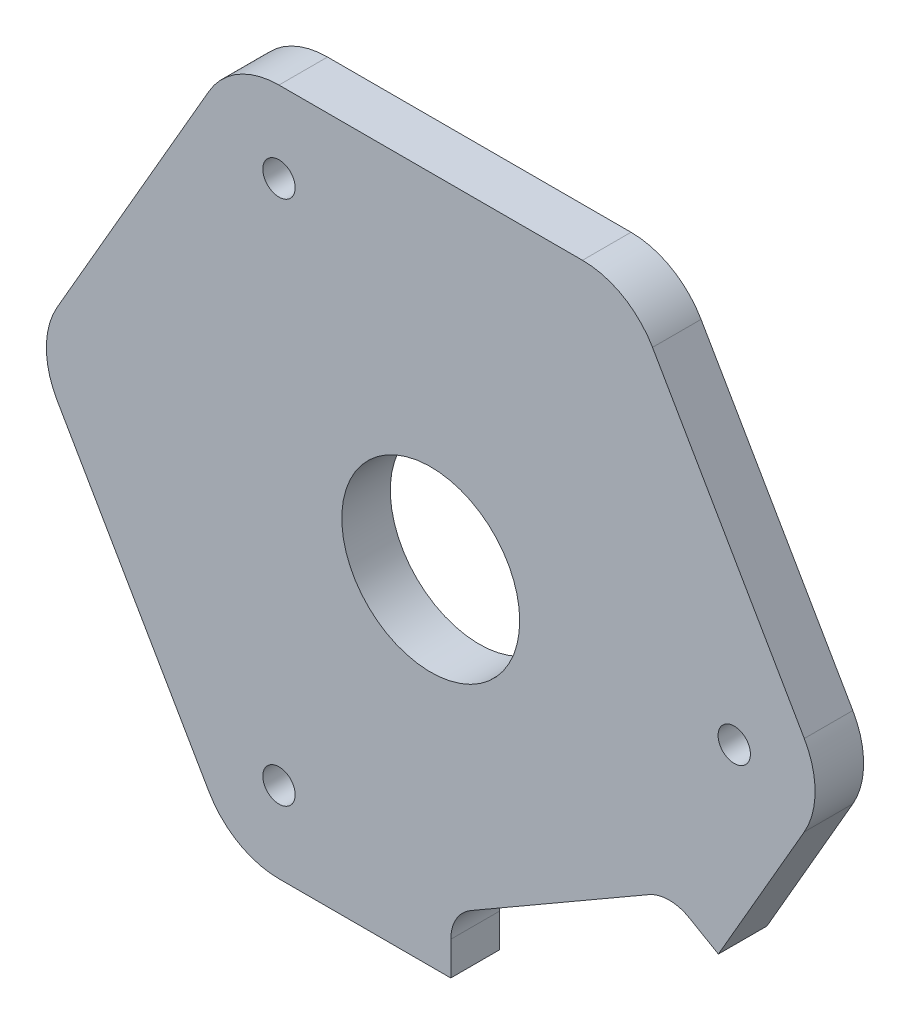
from build123d import *

# Parameters (mm, degrees)
SKETCH1_R           = 2
SKETCH1_R_2         = 11
BOSS_EXTRUDE1_DEPTH = 6


with BuildPart() as part:
    # Sketch1 → Boss-Extrude1 (new body)
    with BuildSketch(Plane.XY):
        with BuildLine():
            Line((-95.228511525, 77.345498823), (-73.987721787, 77.345498823))
            Line((-73.987721787, 77.345498823), (-73.987721787, 81.491705922))
            ThreePointArc((-73.987721787, 81.491705922), (-73.317848806, 83.991705922), (-71.487721787, 85.821832941))
            Line((-71.487721787, 85.821832941), (-49.487721787, 98.523538863))
            ThreePointArc((-49.487721787, 98.523538863), (-46.987721787, 99.193411844), (-44.487721787, 98.523538863))
            Line((-44.487721787, 98.523538863), (-40.89700111, 96.450435314))
            Line((-40.89700111, 96.450435314), (-30.276606241, 114.845498823))
            ThreePointArc((-30.276606241, 114.845498823), (-28.936860279, 119.845498823), (-30.276606241, 124.845498823))
            Line((-30.276606241, 124.845498823), (-49.04048999, 157.345498823))
            ThreePointArc((-49.04048999, 157.345498823), (-52.700744028, 161.005752861), (-57.700744028, 162.345498823))
            Line((-57.700744028, 162.345498823), (-95.228511525, 162.345498823))
            ThreePointArc((-95.228511525, 162.345498823), (-100.228511525, 161.005752861), (-103.888765563, 157.345498823))
            Line((-103.888765563, 157.345498823), (-122.652649312, 124.845498824))
            ThreePointArc((-122.652649312, 124.845498824), (-123.992395274, 119.845498824), (-122.652649312, 114.845498824))
            Line((-122.652649312, 114.845498824), (-103.888765563, 82.345498823))
            ThreePointArc((-103.888765563, 82.345498823), (-100.228511525, 78.685244786), (-95.228511525, 77.345498823))
        make_face()
        with Locations((-38.936860279, 119.845498823)):
            Circle(SKETCH1_R, mode=Mode.SUBTRACT)
        with Locations((-95.228511525, 152.345498823)):
            Circle(SKETCH1_R, mode=Mode.SUBTRACT)
        with Locations((-76.464627777, 119.845498823)):
            Circle(SKETCH1_R_2, mode=Mode.SUBTRACT)
        with Locations((-95.228511525, 87.345498823)):
            Circle(SKETCH1_R, mode=Mode.SUBTRACT)
    extrude(amount=BOSS_EXTRUDE1_DEPTH)


solid = part.part
